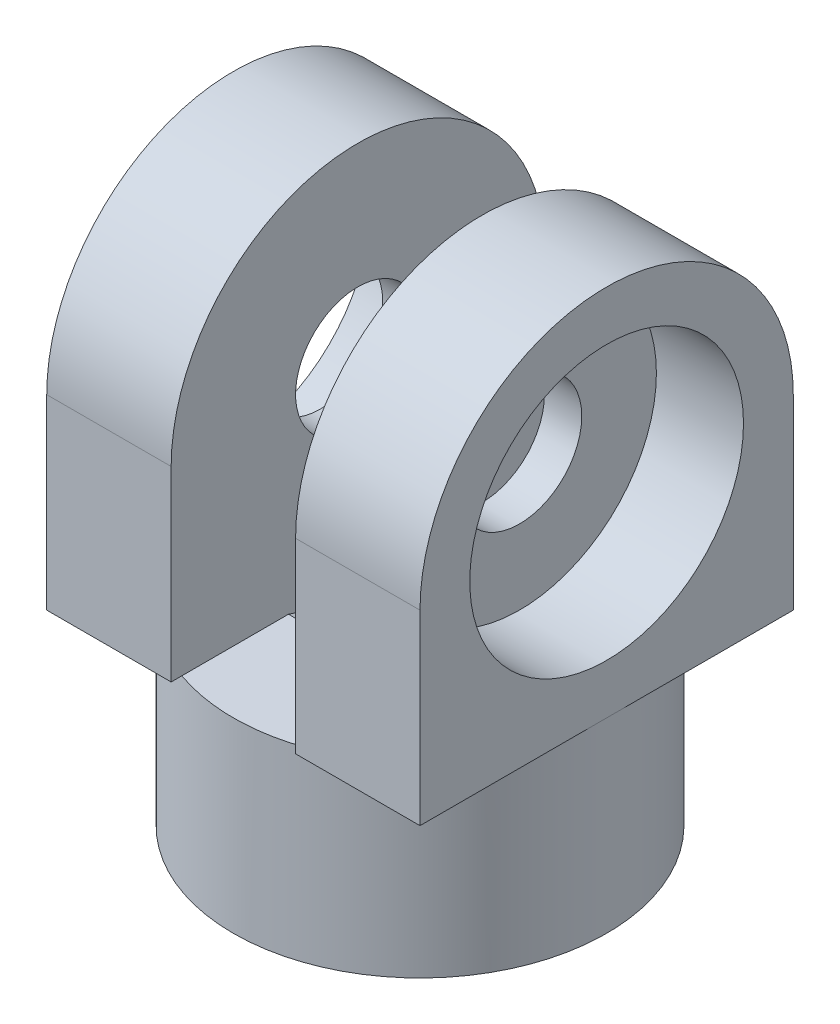
from build123d import *

# Parameters (mm, degrees)
SKETCH1_R           = 15
BOSS_EXTRUDE1_DEPTH = 30
SKETCH8_W           = 30
SKETCH8_H           = 15
REVOLVE1_ANGLE      = 180
SKETCH9_W           = 30
SKETCH9_H           = 30
BOSS_EXTRUDE3_DEPTH = 15
SKETCH10_R          = 5
CUT_EXTRUDE1_DEPTH  = 30
SKETCH13_R          = 16
CUT_EXTRUDE2_DEPTH  = 10
SKETCH14_W          = 10
SKETCH14_H          = 15
CUT_EXTRUDE3_DEPTH  = 67
CUT_EXTRUDE4_START  = -7
SKETCH15_R          = 11
SKETCH15_R_2        = 5
CUT_EXTRUDE4_DEPTH  = 7
SKETCH16_R          = 11
SKETCH16_R_2        = 5
CUT_EXTRUDE5_DEPTH  = 7


with BuildPart() as part:
    # Sketch1 → Boss-Extrude1 (new body)
    with BuildSketch(Plane(origin=(0, 0, 0), x_dir=(1, 0, 0), z_dir=(0, 1, 0))):
        with Locations(Location((0, 0, 0), (0, 0, 270))):
            Circle(SKETCH1_R)
    extrude(amount=BOSS_EXTRUDE1_DEPTH)

    # Sketch8 → Revolve1 (revolve)
    with BuildSketch(Plane(origin=(0, 30, 0), x_dir=(1, 0, 0), z_dir=(0, 1, 0))):
        with Locations((0, -7.5)):
            Rectangle(SKETCH8_W, SKETCH8_H)
    revolve(axis=Axis((15, 30, 0), (-1, 0, 0)), revolution_arc=REVOLVE1_ANGLE)

    # Sketch9 → Boss-Extrude3 (add)
    with BuildSketch(Plane.XZ.offset(-30)):
        Rectangle(SKETCH9_W, SKETCH9_H)
    extrude(amount=BOSS_EXTRUDE3_DEPTH)

    # Sketch10 → Cut-Extrude1 (cut)
    with BuildSketch(Plane(origin=(15, 0, 0), x_dir=(0, 0, -1), z_dir=(1, 0, 0))):
        with Locations((0, 30)):
            Circle(SKETCH10_R)
    extrude(amount=-CUT_EXTRUDE1_DEPTH, mode=Mode.SUBTRACT)

    # Sketch13 → Cut-Extrude2 (cut)
    with BuildSketch(Plane(origin=(5, 0, 0), x_dir=(0, 0, -1), z_dir=(1, 0, 0))):
        with Locations((0, 30)):
            Circle(SKETCH13_R)
    extrude(amount=-CUT_EXTRUDE2_DEPTH, mode=Mode.SUBTRACT)

    # Sketch14 → Cut-Extrude3 (cut)
    with BuildSketch(Plane.XY.offset(15)):
        with Locations((0, 22.5)):
            Rectangle(SKETCH14_W, SKETCH14_H)
    extrude(amount=-CUT_EXTRUDE3_DEPTH, mode=Mode.SUBTRACT)

    # Sketch15 → Cut-Extrude4 (cut)
    with BuildSketch(Plane.ZY.offset(15).offset(CUT_EXTRUDE4_START)):
        with Locations((0, 30)):
            Circle(SKETCH15_R)
        with Locations(Location((0, 30, 0), (0, 0, 180))):
            Circle(SKETCH15_R_2, mode=Mode.SUBTRACT)
    extrude(amount=CUT_EXTRUDE4_DEPTH, mode=Mode.SUBTRACT)

    # Sketch16 → Cut-Extrude5 (cut)
    with BuildSketch(Plane(origin=(15, 0, 0), x_dir=(0, 0, -1), z_dir=(1, 0, 0))):
        with Locations(Location((0, 30, 0), (0, 0, 180))):
            Circle(SKETCH16_R)
        with Locations((0, 30)):
            Circle(SKETCH16_R_2, mode=Mode.SUBTRACT)
    extrude(amount=-CUT_EXTRUDE5_DEPTH, mode=Mode.SUBTRACT)


solid = part.part
